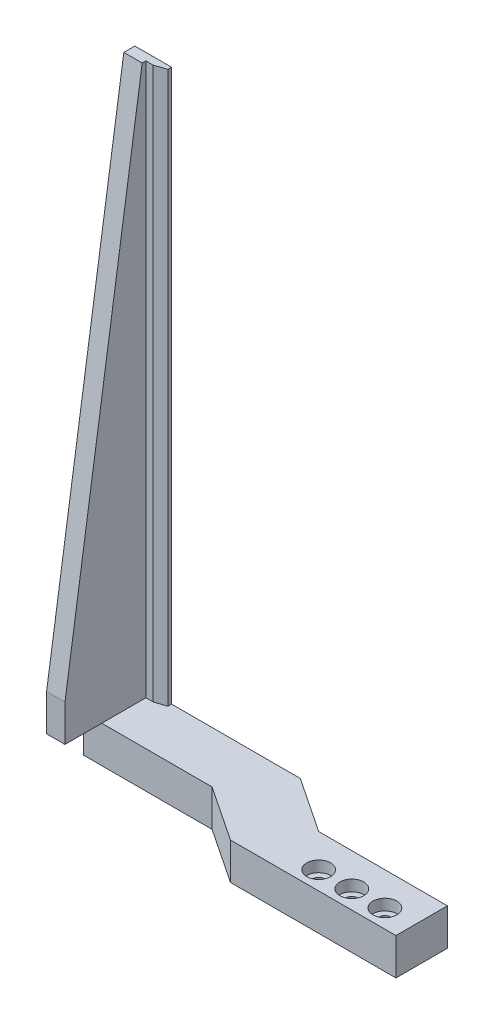
from build123d import *

# Parameters (mm, degrees)
AUFSATZ_LINEAR_AUSTRAGEN1_DEPTH = 2
AUFSATZ_LINEAR_AUSTRAGEN2_DEPTH = 22
SCHNITT_LINEAR_AUSTRAGEN1_REACH = 189.619
FASE1_SIZE                      = 1
FASE1_SIZE2                     = 3
SCHNITT_LINEAR_AUSTRAGEN2_REACH = 186.665
SKIZZE4_R                       = 1.7
SKIZZE5_R                       = 3.25
SCHNITT_LINEAR_AUSTRAGEN3_DEPTH = 3
SCHNITT_LINEAR_AUSTRAGEN4_REACH = 186.665


with BuildPart() as part:
    # Skizze1 → Aufsatz-Linear austragen1 (new body)
    with BuildSketch(Plane.XY):
        Polygon((-10, 10), (-95, 10), (-95, 160), (-105, 160), (-105, 0), (-10, 0), align=None)
    extrude(amount=AUFSATZ_LINEAR_AUSTRAGEN1_DEPTH)

    # Skizze2 → Aufsatz-Linear austragen2 (add)
    with BuildSketch(Plane.XY.offset(2)):
        Polygon((-105, 0), (-10, 0), (-10, 10), (-100, 10), (-100, 160), (-105, 160), align=None)
    extrude(amount=AUFSATZ_LINEAR_AUSTRAGEN2_DEPTH)

    # Skizze3 → Schnitt-Linear austragen1 (cut, up to next)
    with BuildSketch(Plane.ZY.offset(105), mode=Mode.PRIVATE) as schnitt_linear_austragen1_sk1:
        Polygon((3, 160), (24, 160), (24, 20), align=None)
    schnitt_linear_austragen1_tool1 = extrude(schnitt_linear_austragen1_sk1.sketch, amount=-SCHNITT_LINEAR_AUSTRAGEN1_REACH, mode=Mode.PRIVATE) & part.part
    add(schnitt_linear_austragen1_tool1.solids().sort_by_distance((-105, 113.333333, 17))[0], mode=Mode.SUBTRACT)

    # Fase1
    fase1_edges = [part.edges().sort_by_distance(p)[0] for p in [
        (-95, 85, 2),
    ]]
    fase1_side = [part.faces().sort_by_distance(p)[0] for p in [
        (-95, 85, 1),
    ]]
    chamfer(fase1_edges, length=FASE1_SIZE, length2=FASE1_SIZE2, reference=fase1_side[0])

    # Skizze4 → Schnitt-Linear austragen2 (cut, up to next)
    with BuildSketch(Plane(origin=(0, 10, 0), x_dir=(1, 0, 0), z_dir=(0, 1, 0)), mode=Mode.PRIVATE) as schnitt_linear_austragen2_sk1:
        with Locations(Location((-18, -19, 0), (0, 0, 270))):
            Circle(SKIZZE4_R)
    schnitt_linear_austragen2_tool1 = extrude(schnitt_linear_austragen2_sk1.sketch, amount=-SCHNITT_LINEAR_AUSTRAGEN2_REACH, mode=Mode.PRIVATE) & part.part
    # Skizze4 → Schnitt-Linear austragen2 (cut, up to next)
    with BuildSketch(Plane(origin=(0, 10, 0), x_dir=(1, 0, 0), z_dir=(0, 1, 0)), mode=Mode.PRIVATE) as schnitt_linear_austragen2_sk2:
        with Locations(Location((-27, -19, 0), (0, 0, 270))):
            Circle(SKIZZE4_R)
    schnitt_linear_austragen2_tool2 = extrude(schnitt_linear_austragen2_sk2.sketch, amount=-SCHNITT_LINEAR_AUSTRAGEN2_REACH, mode=Mode.PRIVATE) & part.part
    # Skizze4 → Schnitt-Linear austragen2 (cut, up to next)
    with BuildSketch(Plane(origin=(0, 10, 0), x_dir=(1, 0, 0), z_dir=(0, 1, 0)), mode=Mode.PRIVATE) as schnitt_linear_austragen2_sk3:
        with Locations(Location((-36, -19, 0), (0, 0, 270))):
            Circle(SKIZZE4_R)
    schnitt_linear_austragen2_tool3 = extrude(schnitt_linear_austragen2_sk3.sketch, amount=-SCHNITT_LINEAR_AUSTRAGEN2_REACH, mode=Mode.PRIVATE) & part.part
    add(schnitt_linear_austragen2_tool1.solids().sort_by_distance((-18, 10, 19))[0], mode=Mode.SUBTRACT)
    add(schnitt_linear_austragen2_tool2.solids().sort_by_distance((-27, 10, 19))[0], mode=Mode.SUBTRACT)
    add(schnitt_linear_austragen2_tool3.solids().sort_by_distance((-36, 10, 19))[0], mode=Mode.SUBTRACT)

    # Skizze5 → Schnitt-Linear austragen3 (cut)
    with BuildSketch(Plane(origin=(0, 10, 0), x_dir=(1, 0, 0), z_dir=(0, 1, 0))):
        with Locations(Location((-18, -19, 0), (0, 0, 180))):
            Circle(SKIZZE5_R)
        with Locations(Location((-27, -19, 0), (0, 0, 180))):
            Circle(SKIZZE5_R)
        with Locations(Location((-36, -19, 0), (0, 0, 180))):
            Circle(SKIZZE5_R)
    extrude(amount=-SCHNITT_LINEAR_AUSTRAGEN3_DEPTH, mode=Mode.SUBTRACT)

    # Skizze6 → Schnitt-Linear austragen4 (cut, up to next)
    with BuildSketch(Plane(origin=(0, 10, 0), x_dir=(1, 0, 0), z_dir=(0, 1, 0)), mode=Mode.PRIVATE) as schnitt_linear_austragen4_sk1:
        Polygon((-10, -10), (-10, 0), (-60, 0), (-45, -10), align=None)
    schnitt_linear_austragen4_tool1 = extrude(schnitt_linear_austragen4_sk1.sketch, amount=-SCHNITT_LINEAR_AUSTRAGEN4_REACH, mode=Mode.PRIVATE) & part.part
    # Skizze6 → Schnitt-Linear austragen4 (cut, up to next)
    with BuildSketch(Plane(origin=(0, 10, 0), x_dir=(1, 0, 0), z_dir=(0, 1, 0)), mode=Mode.PRIVATE) as schnitt_linear_austragen4_sk2:
        Polygon((-55, -24), (-70, -14), (-105, -14), (-105, -24), align=None)
    schnitt_linear_austragen4_tool2 = extrude(schnitt_linear_austragen4_sk2.sketch, amount=-SCHNITT_LINEAR_AUSTRAGEN4_REACH, mode=Mode.PRIVATE) & part.part
    add(schnitt_linear_austragen4_tool1.solids().sort_by_distance((-31.470588, 10, 4.705882))[0], mode=Mode.SUBTRACT)
    add(schnitt_linear_austragen4_tool2.solids().sort_by_distance((-83.529412, 10, 19.294118))[0], mode=Mode.SUBTRACT)


solid = part.part
